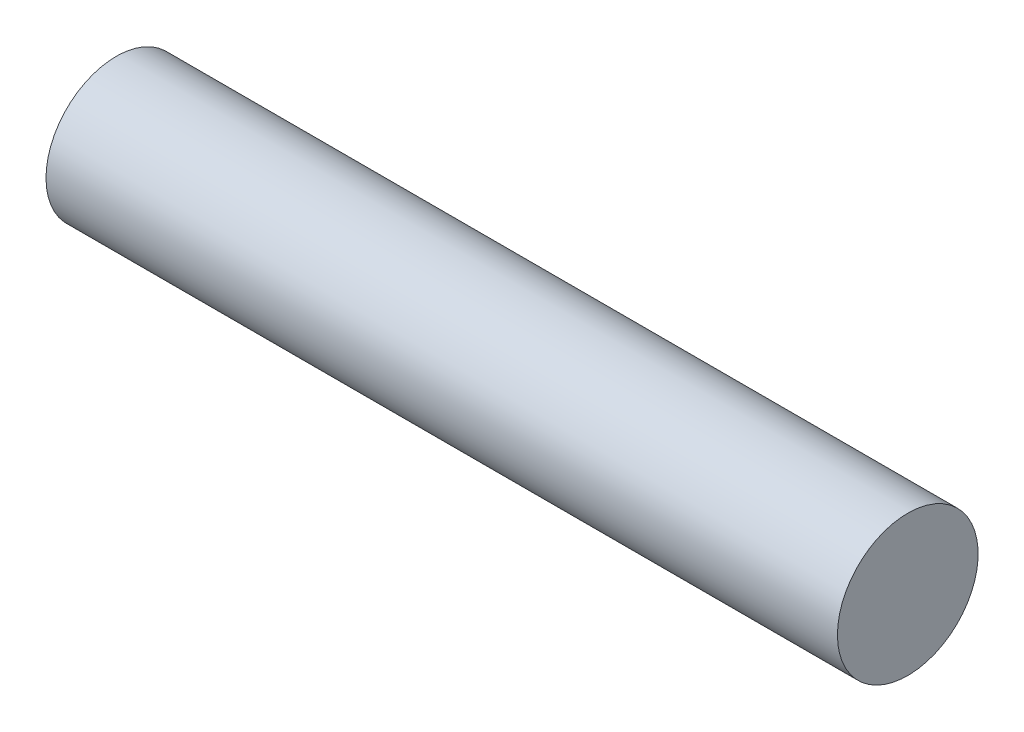
from build123d import *

# Parameters (mm, degrees)
SKETCH_1_W = 90
SKETCH_1_H = 8


with BuildPart() as part:
    # 草图1 → 旋转1 (revolve)
    with BuildSketch(Plane.XY, mode=Mode.PRIVATE) as revolve_1_sk:
        with Locations((45, 4)):
            Rectangle(SKETCH_1_W, SKETCH_1_H)
    revolve(revolve_1_sk.sketch.rotate(Axis((0, 0, 0), (1, 0, 0)), 90), axis=Axis((0, 0, 0), (1, 0, 0)))


solid = part.part
